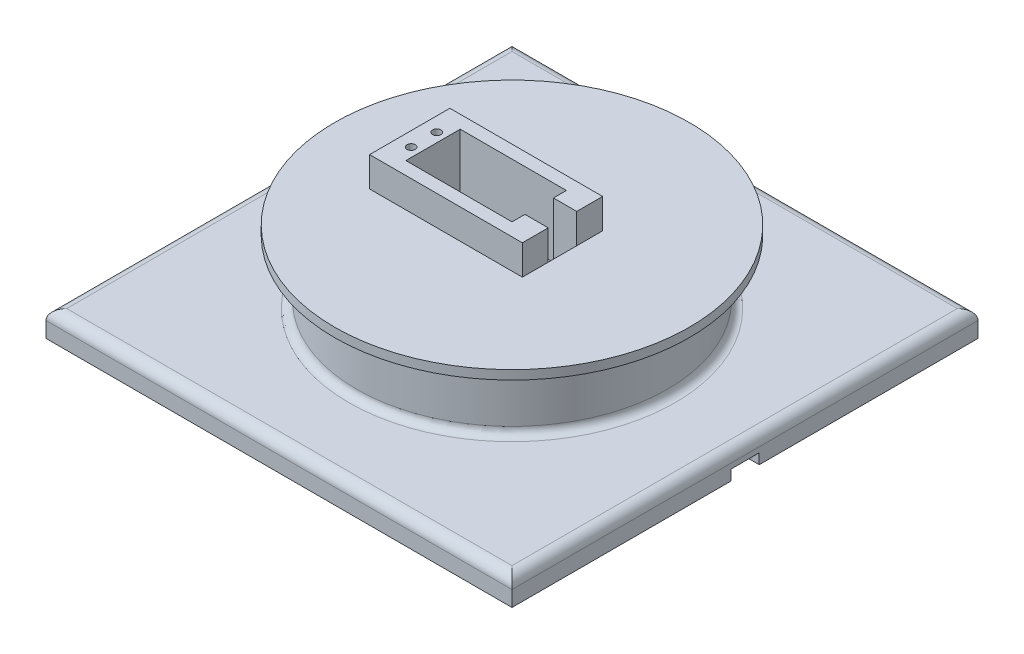
from build123d import *

# Parameters (mm, degrees)
ESQUISSE1_W             = 180
ESQUISSE1_H             = 180
CARR_DEPTH              = 10
ESQUISSE2_R             = 60
ROND_DEPTH              = 28
CONG_2_R                = 4
CONG_8_R                = 3
ESQUISSE27_R            = 68.5
BOSS_EXTRU_2_DEPTH      = 3.5
ESQUISSE20_W            = 41
ESQUISSE20_H            = 21
ENL_V_MAT_EXTRU_1_DEPTH = 15
ESQUISSE21_W            = 59
ESQUISSE21_H            = 31
ESQUISSE21_W_2          = 41
ESQUISSE21_H_2          = 21
BOSS_EXTRU_1_DEPTH      = 26.5
D_GAGEMENT_M31_D        = 3.2
D_GAGEMENT_M31_DEPTH    = 4
D_GAGEMENT_M31_TIP      = 0.96137699
ENL_V_MAT_EXTRU_2_REACH = 138.566
ESQUISSE25_W            = 9
ESQUISSE25_H            = 11
ESQUISSE26_W            = 11
ESQUISSE26_H            = 4
ENL_V_MAT_EXTRU_3_DEPTH = 151.134939305


with BuildPart() as part:
    # Esquisse1 → Carré (new body)
    with BuildSketch(Plane(origin=(0, 0, 0), x_dir=(1, 0, 0), z_dir=(0, 1, 0))):
        Rectangle(ESQUISSE1_W, ESQUISSE1_H)
    extrude(amount=CARR_DEPTH)

    # Esquisse2 → Rond (add)
    with BuildSketch(Plane(origin=(0, 10, 0), x_dir=(1, 0, 0), z_dir=(0, 1, 0))):
        with Locations(Location((0, 0, 0), (0, 0, 270))):
            Circle(ESQUISSE2_R)
    extrude(amount=ROND_DEPTH)

    # Congé2
    cong_2_edges = [part.edges().sort_by_distance(p)[0] for p in [
        (-90, 10, 0),
        (0, 10, 90),
        (90, 10, 0),
        (0, 10, -90),
    ]]
    fillet(cong_2_edges, radius=CONG_2_R)

    # Congé8
    cong_8_edges = [part.edges().sort_by_distance(p)[0] for p in [
        (0, 10, -60),
    ]]
    fillet(cong_8_edges, radius=CONG_8_R)

    # Esquisse27 → Boss.-Extru.2 (add)
    with BuildSketch(Plane(origin=(0, 38, 0), x_dir=(1, 0, 0), z_dir=(0, 1, 0))):
        with Locations(Location((0, 0, 0), (0, 0, 270))):
            Circle(ESQUISSE27_R)
    extrude(amount=-BOSS_EXTRU_2_DEPTH)

    # Esquisse20 → Enlèv. mat.-Extru.1 (cut)
    with BuildSketch(Plane(origin=(0, 38, 0), x_dir=(1, 0, 0), z_dir=(0, 1, 0))):
        with Locations((-10, 0)):
            Rectangle(ESQUISSE20_W, ESQUISSE20_H)
    extrude(amount=-ENL_V_MAT_EXTRU_1_DEPTH, mode=Mode.SUBTRACT)

    # Esquisse21 → Boss.-Extru.1 (add)
    with BuildSketch(Plane(origin=(0, 23, 0), x_dir=(1, 0, 0), z_dir=(0, 1, 0))):
        with Locations((-10, 0)):
            Rectangle(ESQUISSE21_W, ESQUISSE21_H)
        with Locations((-10, 0)):
            Rectangle(ESQUISSE21_W_2, ESQUISSE21_H_2, mode=Mode.SUBTRACT)
    extrude(amount=BOSS_EXTRU_1_DEPTH)

    # Dégagement M31
    with Locations(Plane(origin=(0, 49.5, 0), x_dir=(1, 0, 0), z_dir=(0, 1, 0))):
        with Locations((-34, 4.95), (-34, -4.95)):
            Hole(D_GAGEMENT_M31_D / 2, depth=D_GAGEMENT_M31_DEPTH)
            with Locations((0, 0, -(D_GAGEMENT_M31_DEPTH + D_GAGEMENT_M31_TIP / 2))):  # 118° drill point
                Cone(0, D_GAGEMENT_M31_D / 2, D_GAGEMENT_M31_TIP, mode=Mode.SUBTRACT)

    # Enlèv. mat.-Extru.2: up to this face of the body (flat: up to its plane)
    enl_v_mat_extru_2_end = Plane(part.part.faces().sort_by_distance((0, 0, 0))[0])
    # Esquisse25 → Enlèv. mat.-Extru.2 (cut, up to the picked face)
    with BuildSketch(Plane(origin=(0, 49.5, 0), x_dir=(1, 0, 0), z_dir=(0, 1, 0)), mode=Mode.PRIVATE) as enl_v_mat_extru_2_sk1:
        with Locations((15, 0)):
            Rectangle(ESQUISSE25_W, ESQUISSE25_H)
    enl_v_mat_extru_2_tool1 = split(extrude(enl_v_mat_extru_2_sk1.sketch, amount=-ENL_V_MAT_EXTRU_2_REACH, mode=Mode.PRIVATE), bisect_by=enl_v_mat_extru_2_end, keep=Keep.BOTH, mode=Mode.PRIVATE)
    add(enl_v_mat_extru_2_tool1.solids().sort_by(Axis((15, 49.5, 0), (0, -1, 0)))[0], mode=Mode.SUBTRACT)

    # Esquisse26 → Enlèv. mat.-Extru.3 (cut, through all)
    with BuildSketch(Plane.ZY.offset(-19.5)):
        with Locations((0, 2)):
            Rectangle(ESQUISSE26_W, ESQUISSE26_H)
    extrude(amount=-ENL_V_MAT_EXTRU_3_DEPTH, mode=Mode.SUBTRACT)


solid = part.part
